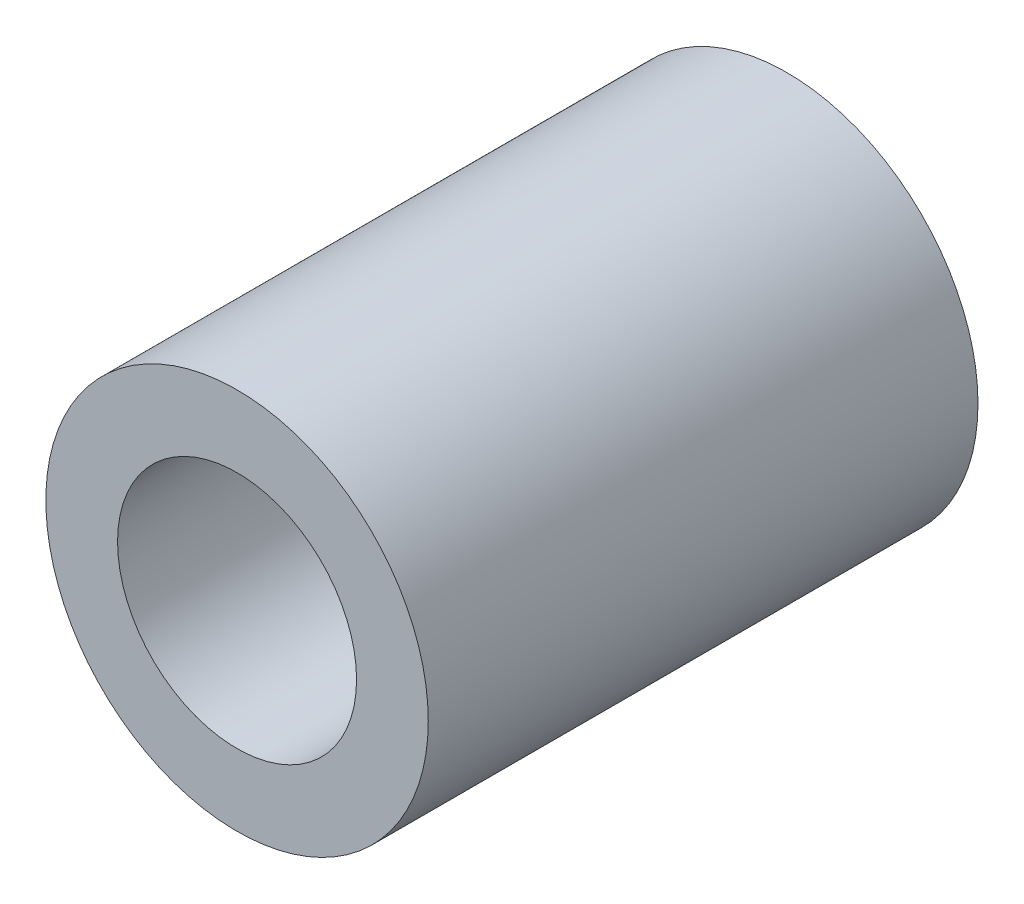
from build123d import *

# Parameters (mm, degrees)
SKIZZE1_R                       = 8
SKIZZE1_R_2                     = 2.5
AUFSATZ_LINEAR_AUSTRAGEN1_DEPTH = 23
SKIZZE2_R                       = 5
SCHNITT_LINEAR_AUSTRAGEN1_DEPTH = 11.5


with BuildPart() as part:
    # Skizze1 → Aufsatz-Linear austragen1 (new body)
    with BuildSketch(Plane.XY):
        Circle(SKIZZE1_R)
        Circle(SKIZZE1_R_2, mode=Mode.SUBTRACT)
    extrude(amount=AUFSATZ_LINEAR_AUSTRAGEN1_DEPTH)

    # Skizze2 → Schnitt-Linear austragen1 (cut)
    with BuildSketch(Plane.XY.offset(23)):
        Circle(SKIZZE2_R)
    extrude(amount=-SCHNITT_LINEAR_AUSTRAGEN1_DEPTH, mode=Mode.SUBTRACT)


solid = part.part
